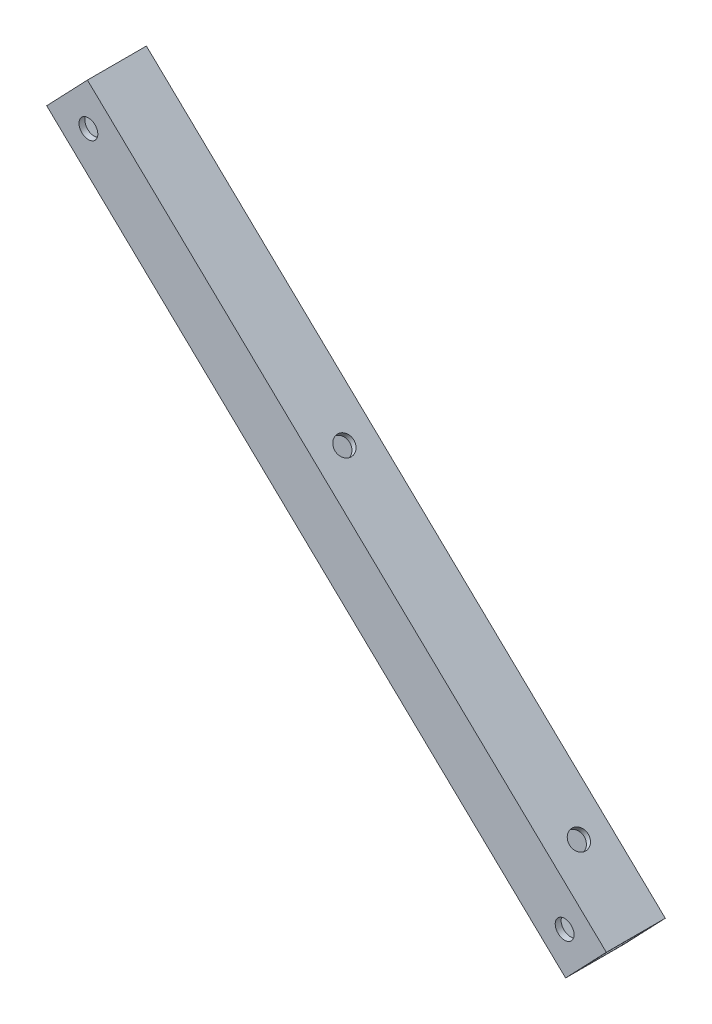
from build123d import *

# Parameters (mm, degrees)
SKETCH_2_R          = 1.6
EXTRUDE_1_DEPTH     = 10
SKETCH_3_W          = 8
SKETCH_3_H          = 8
CUT_EXTRUDE_1_DEPTH = 140.947387002
CUT_EXTRUDE_3_DEPTH = 10


with BuildPart() as part:
    # ｽｹｯﾁ2 → ﾎﾞｽ - 押し出し1 (new body)
    with BuildSketch(Plane.XY):
        Polygon((83.071643169, 8.195972832), (-3.936021884, 91.354077293), (-10.845357286, 84.124894469), (77.150331852, 0.022479987), (84.059667254, 7.25166281), align=None)
        with Locations((-3.776098173, 84.28481818)):
            Circle(SKETCH_2_R, mode=Mode.SUBTRACT)
        with Locations((76.990408141, 7.0917391)):
            Circle(SKETCH_2_R, mode=Mode.SUBTRACT)
    extrude(amount=EXTRUDE_1_DEPTH)

    # ｽｹｯﾁ3 → ｶｯﾄ - 押し出し1 (cut, through all)
    with BuildSketch(Plane(origin=(40.308371471, -38.524970914, 0), x_dir=(0, 0, -1), z_dir=(0.7229182823698357, -0.690933540230496, 0))):
        with Locations((-5, 58.32200311)):
            Rectangle(SKETCH_3_W, SKETCH_3_H)
    extrude(amount=-CUT_EXTRUDE_1_DEPTH, mode=Mode.SUBTRACT)

    # ｽｹｯﾁ5 → ｶｯﾄ - 押し出し3 (cut)
    with BuildSketch(Plane(origin=(36.841960381, 38.5474509, 0), x_dir=(0.7229182823698362, -0.6909335402304956, 0), z_dir=(-0.6909335402304956, -0.7229182823698362, 0))):
        with BuildLine():
            ThreePointArc((-11.003582504, 5), (-12.603582504, 6.6), (-14.203582504, 5))
            Line((-14.203582504, 5), (-11.003582504, 5))
        make_face()
        with BuildLine():
            Line((-11.003582504, 5), (-14.203582504, 5))
            ThreePointArc((-14.203582504, 5), (-12.603582504, 3.4), (-11.003582504, 5))
        make_face()
        with BuildLine():
            ThreePointArc((43.996417496, 5), (42.396417496, 6.6), (40.796417496, 5))
            Line((40.796417496, 5), (43.996417496, 5))
        make_face()
        with BuildLine():
            Line((43.996417496, 5), (40.796417496, 5))
            ThreePointArc((40.796417496, 5), (42.396417496, 3.4), (43.996417496, 5))
        make_face()
    extrude(amount=-CUT_EXTRUDE_3_DEPTH, mode=Mode.SUBTRACT)


solid = part.part
